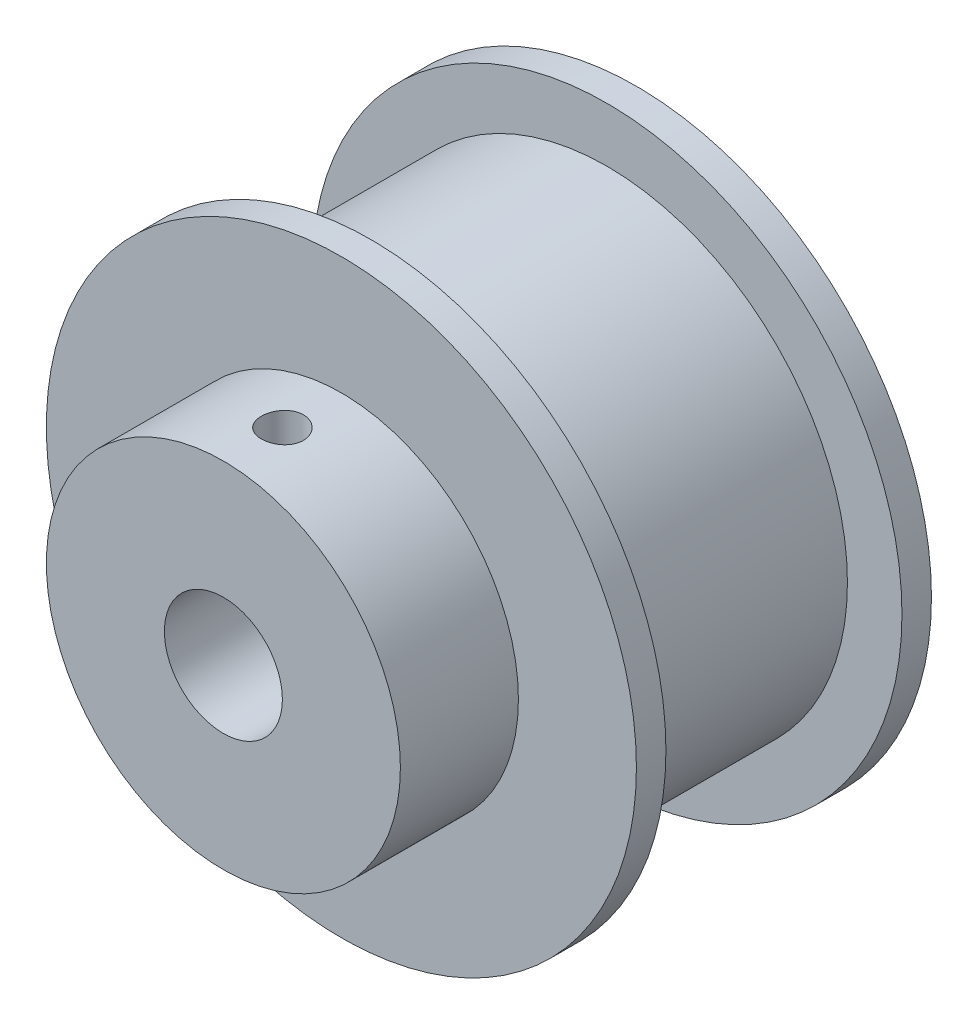
from build123d import *

# Parameters (mm, degrees)
F_4_40_TAPPED_HOLE1_D              = 2.2606
F_4_40_TAPPED_HOLE1_DEPTH          = 8.89
F_4_40_TAPPED_HOLE1_TIP            = 0.679152758
SOME_SET_SCREW_UNKNOWN_SIZE_REACH  = 39.298
SOME_SET_SCREW_UNKNOWN_SIZE_BORE_R = 1.1303


with BuildPart() as part:
    # Sketch2 → Revolve1 (revolve)
    with BuildSketch(Plane(origin=(0, 0, 0), x_dir=(0, 0, -1), z_dir=(1, 0, 0)), mode=Mode.PRIVATE) as revolve1_sk:
        Polygon((0, 9.525), (0, 3.175), (22.225, 3.175), (22.225, 15.875), (20.6375, 15.875), (20.6375, 12.9413), (7.9375, 12.9413), (7.9375, 15.875), (6.35, 15.875), (6.35, 9.525), align=None)
    revolve(revolve1_sk.sketch.rotate(Axis((0, 0, 0), (0, 0, -1)), 90), axis=Axis((0, 0, 0), (0, 0, -1)))

    # #4-40 Tapped Hole1
    with Locations(Plane(origin=(0, 0, -22.225), x_dir=(-1, 0, 0), z_dir=(0, 0, -1))):
        with Locations((0, 7.9375), (6.874076643, 3.96875), (6.874076643, -3.96875), (0, -7.9375), (-6.874076643, -3.96875), (-6.874076643, 3.96875)):
            Hole(F_4_40_TAPPED_HOLE1_D / 2, depth=F_4_40_TAPPED_HOLE1_DEPTH)
            with Locations((0, 0, -(F_4_40_TAPPED_HOLE1_DEPTH + F_4_40_TAPPED_HOLE1_TIP / 2))):  # 118° drill point
                Cone(0, F_4_40_TAPPED_HOLE1_D / 2, F_4_40_TAPPED_HOLE1_TIP, mode=Mode.SUBTRACT)

    # Some set screw. Unknown size bore → Some set screw. Unknown size (cut, up to next)
    with BuildSketch(Plane(origin=(0, 9.525, 0), x_dir=(1, 0, 0), z_dir=(0, 1, 0)), mode=Mode.PRIVATE) as some_set_screw_unknown_size_sk1:
        with Locations((0, 3.175)):
            Circle(SOME_SET_SCREW_UNKNOWN_SIZE_BORE_R)
    some_set_screw_unknown_size_tool1 = extrude(some_set_screw_unknown_size_sk1.sketch, amount=-SOME_SET_SCREW_UNKNOWN_SIZE_REACH, mode=Mode.PRIVATE) & part.part
    add(some_set_screw_unknown_size_tool1.solids().sort_by_distance((0, 9.525, -3.175))[0], mode=Mode.SUBTRACT)


solid = part.part
